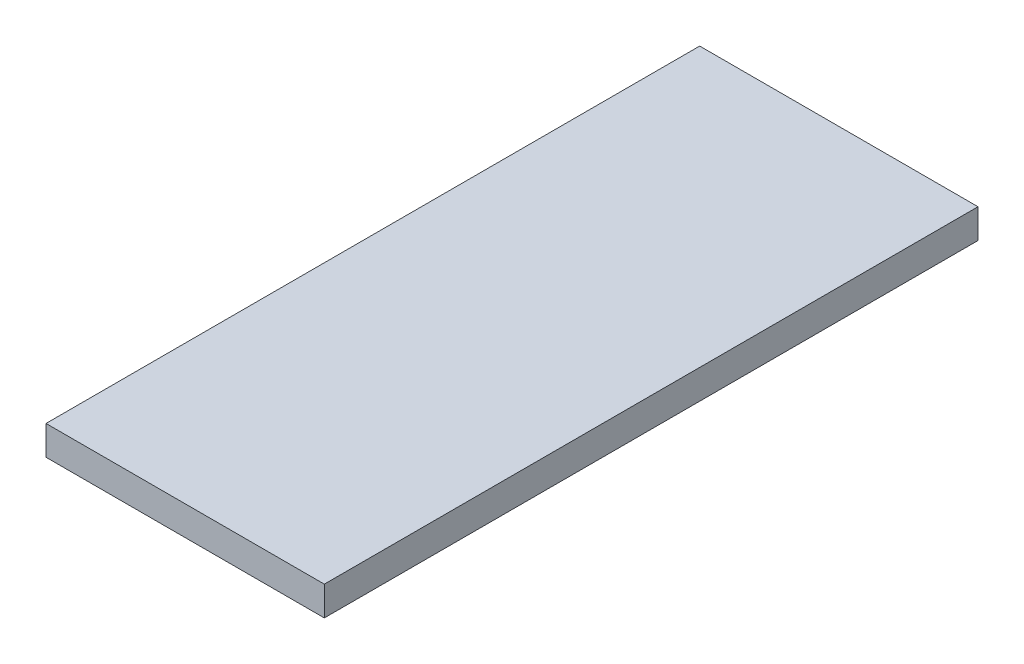
from build123d import *

# Parameters (mm, degrees)
SKETCH_1_W      = 15.2
SKETCH_1_H      = 35.7
EXTRUDE_1_DEPTH = 1.6


with BuildPart() as part:
    # 草图1 → 凸台-拉伸1 (new body)
    with BuildSketch(Plane(origin=(0, 0, 0), x_dir=(1, 0, 0), z_dir=(0, 1, 0))):
        Rectangle(SKETCH_1_W, SKETCH_1_H)
    extrude(amount=EXTRUDE_1_DEPTH)


solid = part.part
